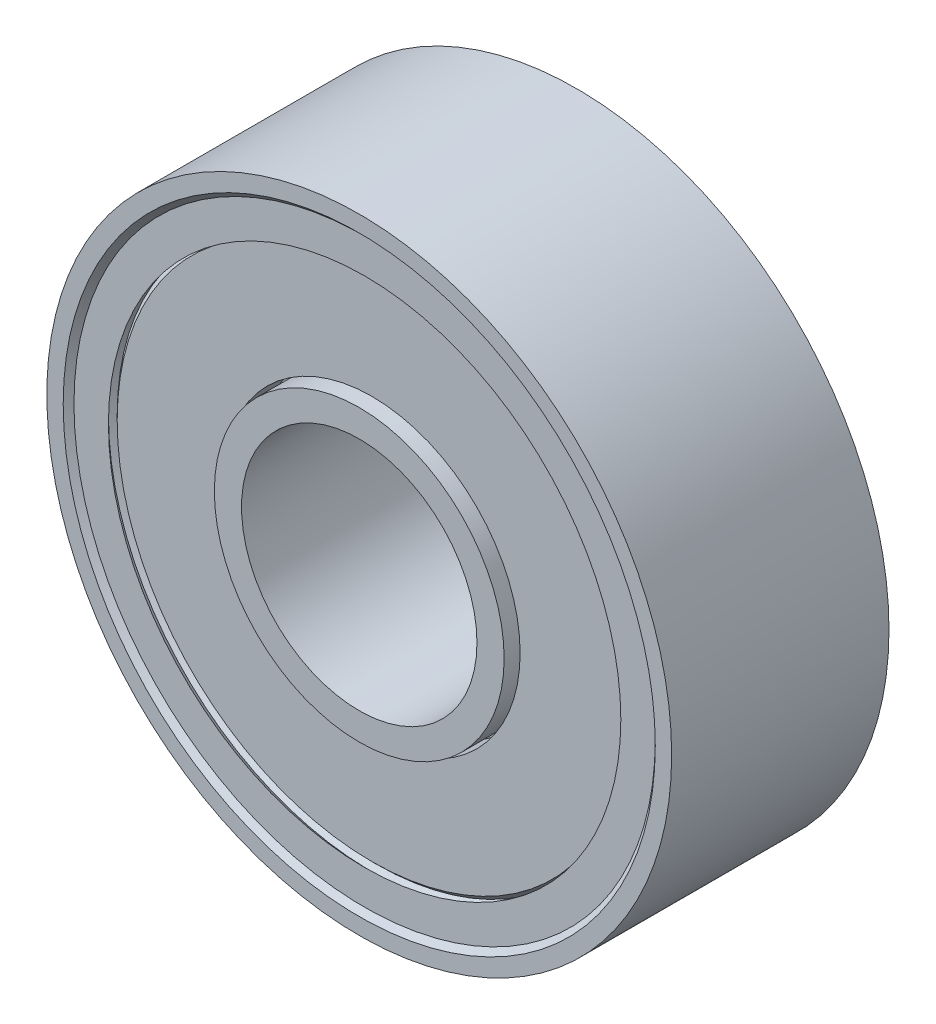
from build123d import *

# Parameters (mm, degrees)
SKETCH1_R           = 6.9
SKETCH1_R_2         = 2.6
BOSS_EXTRUDE1_DEPTH = 4.8


with BuildPart() as part:
    # Sketch1 → Boss-Extrude1 (new body)
    with BuildSketch(Plane.XY):
        Circle(SKETCH1_R)
        Circle(SKETCH1_R_2, mode=Mode.SUBTRACT)
    extrude(amount=BOSS_EXTRUDE1_DEPTH)

    # Sketch2 → Cut-Revolve1 (revolve, cut)
    with BuildSketch(Plane(origin=(0, 0, 0), x_dir=(0, 0, -1), z_dir=(1, 0, 0)), mode=Mode.PRIVATE) as cut_revolve1_sk:
        Polygon((-5.047973747, 6.3), (-4.9457756, 6.3), (-4.9457756, 6.684089002), (-4.6811872, 6.419500602), (-4.6811872, 5.658380737), (-4.519629847, 5.81993809), (-4.422921243, 5.723229486), (-4.519629847, 5.626520881), (-4.519629847, 3.272939667), (-3.81743033, 3.272939667), (-3.81743033, 3.2), (-4.879732163, 3.2), (-4.879732163, 0), (-5.869193326, 0), (-5.869193326, 6.3), align=None)
        Polygon((1.069193326, 6.3), (0.247973747, 6.3), (0.1457756, 6.3), (0.1457756, 6.684089002), (-0.1188128, 6.419500602), (-0.1188128, 5.658380737), (-0.280370153, 5.81993809), (-0.377078757, 5.723229486), (-0.280370153, 5.626520881), (-0.280370153, 3.272939667), (-0.98256967, 3.272939667), (-0.98256967, 3.2), (0.079732163, 3.2), (0.079732163, 0), (1.069193326, 0), align=None)
    revolve(cut_revolve1_sk.sketch.rotate(Axis((0, 0, 4.879732163), (0, 0, 1)), 90), axis=Axis((0, 0, 4.879732163), (0, 0, 1)), mode=Mode.SUBTRACT)


solid = part.part
